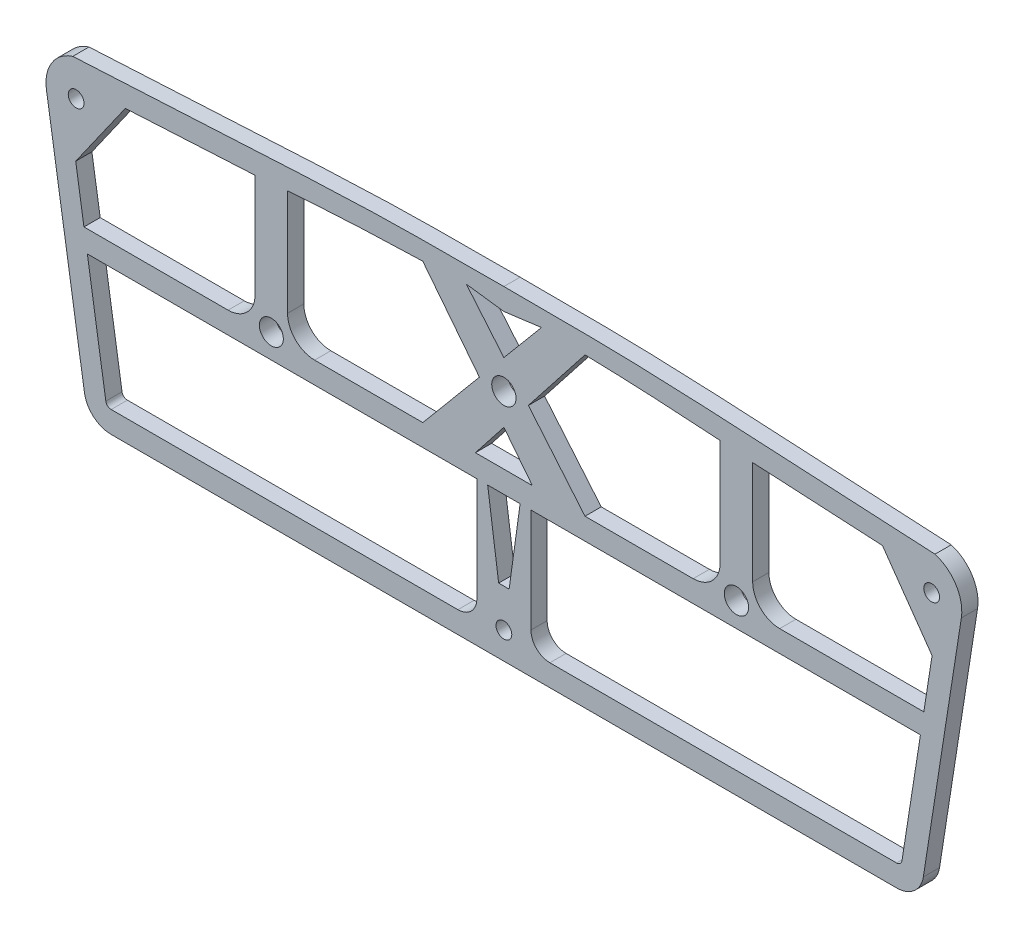
from build123d import *

# Parameters (mm, degrees)
SALIENTE_EXTRUIR3_DEPTH     = 3
CROQUIS10_R                 = 2.21653071
CROQUIS10_R_2               = 2.25
CORTAR_EXTRUIR2_DEPTH       = 3
TALADRO_DE_MARGEN_PARA_32_D = 2.921
TALADRO_DE_MARGEN_PARA_33_D = 2.921


with BuildPart() as part:
    # Croquis1 → Saliente-Extruir3 (new body)
    with BuildSketch(Plane.XY):
        with BuildLine():
            Line((72.6209879, -42.713924632), (-72.6209879, -42.713924632))
            ThreePointArc((-72.6209879, -42.713924632), (-75.872299777, -41.512473181), (-77.561094305, -38.485513064))
            Line((-77.561094305, -38.485513064), (-84.58908741, 6.511317248))
            ThreePointArc((-84.58908741, 6.511317248), (-83.604933224, 11.307915351), (-79.718228228, 14.286075368))
            add(Edge.make_bspline(
                [(-79.718228228, 14.286075368), (-25, 17.286075368), (0, 17.286075368)],
                knots=[0, 0, 0, 1, 1, 1], degree=2, weights=[1, 3, 1]))
            add(Edge.make_bspline(
                [(79.718228228, 14.286075368), (25, 17.286075368), (0, 17.286075368)],
                knots=[0, 0, 0, 1, 1, 1], degree=2, weights=[1, 3, 1]))
            ThreePointArc((79.718228228, 14.286075368), (83.604933224, 11.307915351), (84.58908741, 6.511317248))
            Line((84.58908741, 6.511317248), (77.561094305, -38.485513064))
            ThreePointArc((77.561094305, -38.485513064), (75.872299777, -41.512473181), (72.6209879, -42.713924632))
        make_face()
    extrude(amount=SALIENTE_EXTRUIR3_DEPTH)

    # Croquis10 → Cortar-Extruir2 (cut)
    with BuildSketch(Plane(origin=(0, 0, 0), x_dir=(-1, 0, 0), z_dir=(0, 0, -1))):
        with Locations((43, -11.497393921)):
            Circle(CROQUIS10_R)
        with Locations((-43, -11.497393921)):
            Circle(CROQUIS10_R_2)
        with Locations((0, 0.505728571)):
            Circle(CROQUIS10_R_2)
        with BuildLine():
            Line((-79.176075372, -2.225018285), (-70, 10.811605693))
            add(Edge.make_bspline(
                [(-46, 12.09753452), (-50.398475085, 11.870236703), (-54.796484112, 11.634198791), (-62.796370665, 11.203428332), (-66.398209188, 11.007964378), (-70, 10.811605693)],
                knots=[0.582706917, 0.582706917, 0.582706917, 0.582706917, 0.75, 0.75, 0.887012418, 0.887012418, 0.887012418, 0.887012418], degree=3))
            Line((-46, 12.09753452), (-46, -6.997393921))
            ThreePointArc((-46, -6.997393921), (-47.464466094, -10.532927827), (-51, -11.997393921))
            Line((-51, -11.997393921), (-77.649741448, -11.997393921))
            Line((-77.649741448, -11.997393921), (-79.176075372, -2.225018285))
        make_face()
        with BuildLine():
            Line((79.176075372, -2.225018285), (70, 10.811605693))
            add(Edge.make_bspline(
                [(70, 10.811605693), (66.398209009, 11.007964388), (62.796370304, 11.203428352), (54.796483872, 11.634198804), (50.398474815, 11.870236716), (46, 12.097534519)],
                knots=[0.112987579, 0.112987579, 0.112987579, 0.112987579, 0.25, 0.25, 0.417293066, 0.417293066, 0.417293066, 0.417293066], degree=3))
            Line((46, 12.097534519), (46, -6.997393921))
            ThreePointArc((46, -6.997393921), (47.464466094, -10.532927827), (51, -11.997393921))
            Line((51, -11.997393921), (77.649741448, -11.997393921))
            Line((77.649741448, -11.997393921), (79.176075372, -2.225018285))
        make_face()
        with BuildLine():
            Line((-72.6209879, -38.713924632), (-8.5, -38.713924632))
            ThreePointArc((-8.5, -38.713924632), (-6.025126266, -37.688798366), (-5, -35.213924632))
            Line((-5, -35.213924632), (-5, -34.713924632))
            Line((-5, -34.713924632), (-5, -15.997393921))
            Line((-5, -15.997393921), (-15, -15.997393921))
            Line((-15, -15.997393921), (-77.024986944, -15.997393921))
            Line((-77.024986944, -15.997393921), (-73.609009181, -37.868242318))
            ThreePointArc((-73.609009181, -37.868242318), (-73.271250275, -38.473634342), (-72.6209879, -38.713924632))
        make_face()
        with BuildLine():
            Line((73.609009181, -37.868242318), (77.024986944, -15.997393921))
            Line((77.024986944, -15.997393921), (15, -15.997393921))
            Line((15, -15.997393921), (5, -15.997393921))
            Line((5, -15.997393921), (5, -34.713924632))
            Line((5, -34.713924632), (5, -35.213924632))
            ThreePointArc((5, -35.213924632), (6.025126266, -37.688798366), (8.5, -38.713924632))
            Line((8.5, -38.713924632), (72.6209879, -38.713924632))
            ThreePointArc((72.6209879, -38.713924632), (73.271250275, -38.473634342), (73.609009181, -37.868242318))
        make_face()
        with BuildLine():
            Line((35, -11.997393921), (15, -11.997393921))
            Line((15, -11.997393921), (4.523677721, 0.505728571))
            Line((4.523677721, 0.505728571), (15, 13.84373792))
            add(Edge.make_bspline(
                [(40, 12.63160375), (39.825409867, 12.642923331), (39.650818398, 12.654223436), (36.190665267, 12.877777744), (32.904720181, 13.082746887), (26.330198769, 13.442733043), (23.041359598, 13.592817894), (18.167140708, 13.757695148), (16.583628119, 13.803403068), (15, 13.84373792)],
                knots=[0.49335757, 0.49335757, 0.49335757, 0.49335757, 0.5, 0.5, 0.625, 0.625, 0.75, 0.75, 0.810141441, 0.810141441, 0.810141441, 0.810141441], degree=3))
            Line((40, 12.63160375), (40, -6.997393921))
            ThreePointArc((40, -6.997393921), (38.535533906, -10.532927827), (35, -11.997393921))
        make_face()
        Polygon((-0.968336382, -30.687982025), (-3, -15.997393921), (0, -15.997393921), (3, -15.997393921), (0.968336382, -30.687982025), (0, -30.687982025), align=None)
        Polygon((5.264444392, -11.956093505), (-5.264444392, -11.956093505), (0, -5.253626108), align=None)
        with BuildLine():
            Line((-40, 12.631603781), (-40, -6.997393921))
            ThreePointArc((-40, -6.997393921), (-38.535533906, -10.532927827), (-35, -11.997393921))
            Line((-35, -11.997393921), (-15, -11.997393921))
            Line((-15, -11.997393921), (-4.523677721, 0.505728571))
            Line((-4.523677721, 0.505728571), (-15, 13.84373792))
            add(Edge.make_bspline(
                [(-15, 13.84373792), (-16.58363169, 13.803402978), (-18.167147458, 13.757694961), (-23.041366217, 13.59281763), (-26.330199865, 13.442733005), (-32.904719736, 13.082746935), (-36.190666356, 12.877777704), (-39.650819263, 12.654223411), (-39.8254103, 12.642923334), (-40, 12.631603781)],
                knots=[0.189858469, 0.189858469, 0.189858469, 0.189858469, 0.25, 0.25, 0.375, 0.375, 0.5, 0.5, 0.506642413, 0.506642413, 0.506642413, 0.506642413], degree=3))
        make_face()
        with BuildLine():
            Line((0, 5.904578964), (-6.946573607, 14.195070454))
            add(Edge.make_bspline(
                [(0, 13.286075368), (-2.315177484, 13.591832913), (-4.630580268, 13.895799248), (-6.946573607, 14.195070454)],
                knots=[0, 0, 0, 0, 0.08865715, 0.08865715, 0.08865715, 0.08865715], degree=3))
            add(Edge.make_bspline(
                [(6.946573603, 14.195070449), (4.63058034, 13.895799254), (2.315177538, 13.591832918), (0, 13.286075368)],
                knots=[0.911342821, 0.911342821, 0.911342821, 0.911342821, 1, 1, 1, 1], degree=3))
            Line((6.946573603, 14.195070449), (0, 5.904578964))
        make_face()
    extrude(amount=-CORTAR_EXTRUIR2_DEPTH, mode=Mode.SUBTRACT)

    # Taladro de margen para #32 (through all)
    with Locations(Plane(origin=(79.096485455, 7.800604527, 0), x_dir=(-1, 0, 0), z_dir=(0, 0, -1))):
        with Locations((0, 0), (158.19297091, 0)):
            Hole(TALADRO_DE_MARGEN_PARA_32_D / 2)

    # Taladro de margen para #33 (through all)
    with Locations(Plane(origin=(0, -37.713924632, 0), x_dir=(-1, 0, 0), z_dir=(0, 0, -1))):
        with Locations((0, 0)):
            Hole(TALADRO_DE_MARGEN_PARA_33_D / 2)


solid = part.part
